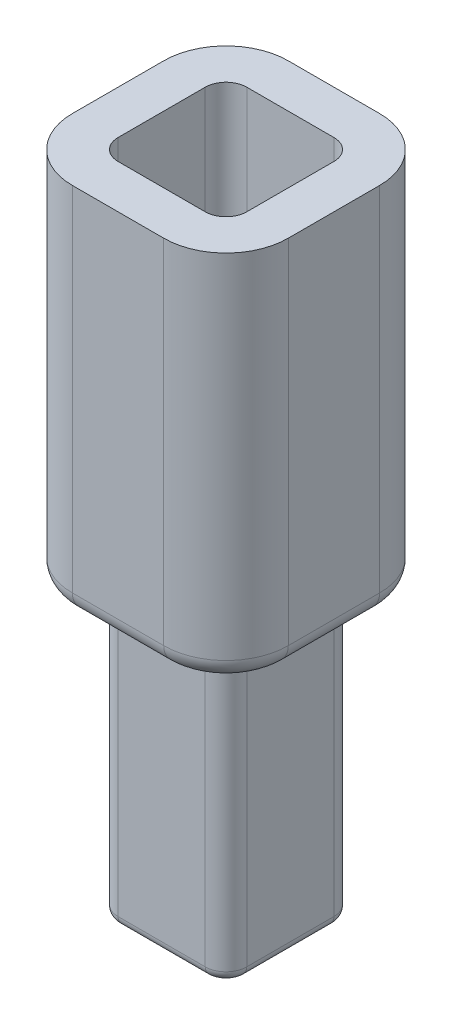
from build123d import *

# Parameters (mm, degrees)
BOSS_EXTRUDE1_DEPTH = 14
BOSS_EXTRUDE2_DEPTH = 18
CUT_EXTRUDE1_START  = -15
CUT_EXTRUDE1_DEPTH  = 15
FILLET4_R           = 1
FILLET5_R           = 0.5


with BuildPart() as part:
    # Sketch1 → Boss-Extrude1 (new body)
    with BuildSketch(Plane(origin=(0, 0, 0), x_dir=(1, 0, 0), z_dir=(0, 1, 0))):
        with BuildLine():
            Line((-2.1, 3.1), (2.1, 3.1))
            ThreePointArc((2.1, 3.1), (2.807106781, 2.807106781), (3.1, 2.1))
            Line((3.1, 2.1), (3.1, -2.1))
            ThreePointArc((3.1, -2.1), (2.807106781, -2.807106781), (2.1, -3.1))
            Line((2.1, -3.1), (-2.1, -3.1))
            ThreePointArc((-2.1, -3.1), (-2.807106781, -2.807106781), (-3.1, -2.1))
            Line((-3.1, -2.1), (-3.1, 2.1))
            ThreePointArc((-3.1, 2.1), (-2.807106781, 2.807106781), (-2.1, 3.1))
        make_face()
    extrude(amount=BOSS_EXTRUDE1_DEPTH)

    # Sketch2 → Boss-Extrude2 (add)
    with BuildSketch(Plane(origin=(0, 14, 0), x_dir=(1, 0, 0), z_dir=(0, 1, 0))):
        with BuildLine():
            Line((-2.2, 5.2), (2.2, 5.2))
            ThreePointArc((2.2, 5.2), (4.321320344, 4.321320344), (5.2, 2.2))
            Line((5.2, 2.2), (5.2, -2.2))
            ThreePointArc((5.2, -2.2), (4.321320344, -4.321320344), (2.2, -5.2))
            Line((2.2, -5.2), (-2.2, -5.2))
            ThreePointArc((-2.2, -5.2), (-4.321320344, -4.321320344), (-5.2, -2.2))
            Line((-5.2, -2.2), (-5.2, 2.2))
            ThreePointArc((-5.2, 2.2), (-4.321320344, 4.321320344), (-2.2, 5.2))
        make_face()
    extrude(amount=BOSS_EXTRUDE2_DEPTH)

    # Sketch3 → Cut-Extrude1 (cut)
    with BuildSketch(Plane(origin=(0, 32, 0), x_dir=(1, 0, 0), z_dir=(0, 1, 0)).offset(CUT_EXTRUDE1_START)):
        with BuildLine():
            Line((-2.1, 3.1), (2.1, 3.1))
            ThreePointArc((2.1, 3.1), (2.807106781, 2.807106781), (3.1, 2.1))
            Line((3.1, 2.1), (3.1, -2.1))
            ThreePointArc((3.1, -2.1), (2.807106781, -2.807106781), (2.1, -3.1))
            Line((2.1, -3.1), (-2.1, -3.1))
            ThreePointArc((-2.1, -3.1), (-2.807106781, -2.807106781), (-3.1, -2.1))
            Line((-3.1, -2.1), (-3.1, 2.1))
            ThreePointArc((-3.1, 2.1), (-2.807106781, 2.807106781), (-2.1, 3.1))
        make_face()
    extrude(amount=CUT_EXTRUDE1_DEPTH, mode=Mode.SUBTRACT)

    # Fillet4
    fillet4_edges = [part.edges().sort_by_distance(p)[0] for p in [
        (-4.321320344, 14, 4.321320344),
        (0, 14, 5.2),
        (4.321320344, 14, 4.321320344),
        (5.2, 14, 0),
        (4.321320344, 14, -4.321320344),
        (0, 14, -5.2),
        (-4.321320344, 14, -4.321320344),
        (-5.2, 14, 0),
    ]]
    fillet(fillet4_edges, radius=FILLET4_R)

    # Fillet5
    fillet5_edges = [part.edges().sort_by_distance(p)[0] for p in [
        (0, 0, -3.1),
        (2.807106781, 0, -2.807106781),
        (3.1, 0, 0),
        (2.807106781, 0, 2.807106781),
        (0, 0, 3.1),
        (-2.807106781, 0, 2.807106781),
        (-3.1, 0, 0),
        (-2.807106781, 0, -2.807106781),
    ]]
    fillet(fillet5_edges, radius=FILLET5_R)


solid = part.part
